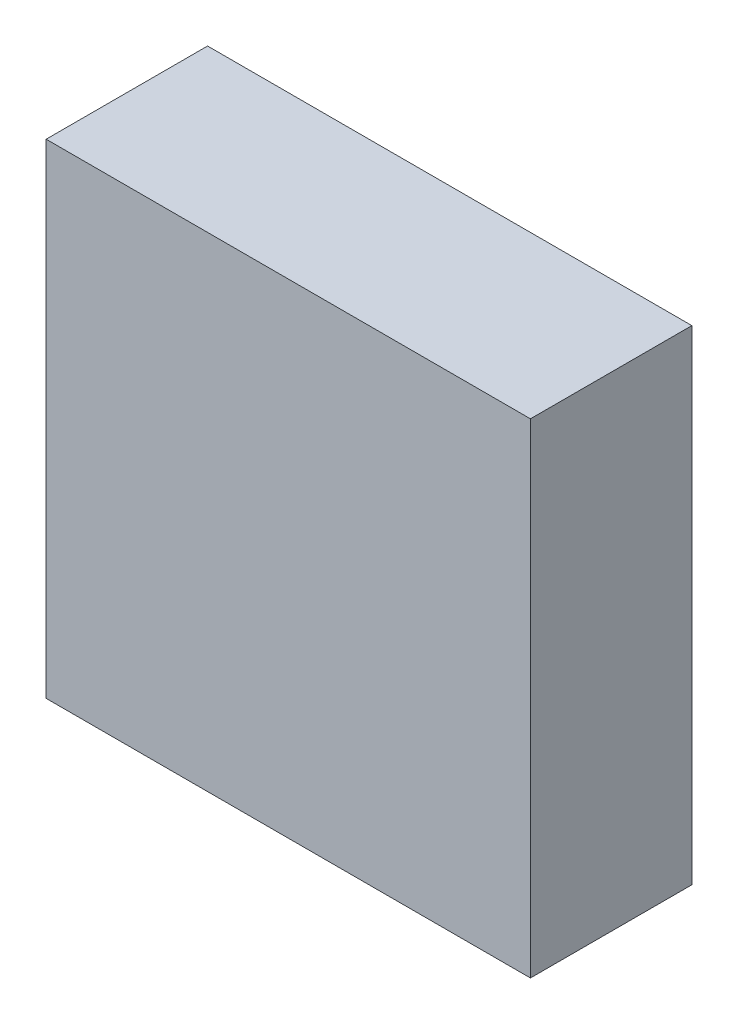
from build123d import *

# Parameters (mm, degrees)
SK_BASE_W    = 30
SK_BASE_H    = 30
EX_BOX_DEPTH = 10


with BuildPart() as part:
    # SK_Base → EX_Box (new body)
    with BuildSketch(Plane.XY):
        Rectangle(SK_BASE_W, SK_BASE_H)
    extrude(amount=EX_BOX_DEPTH)


solid = part.part
